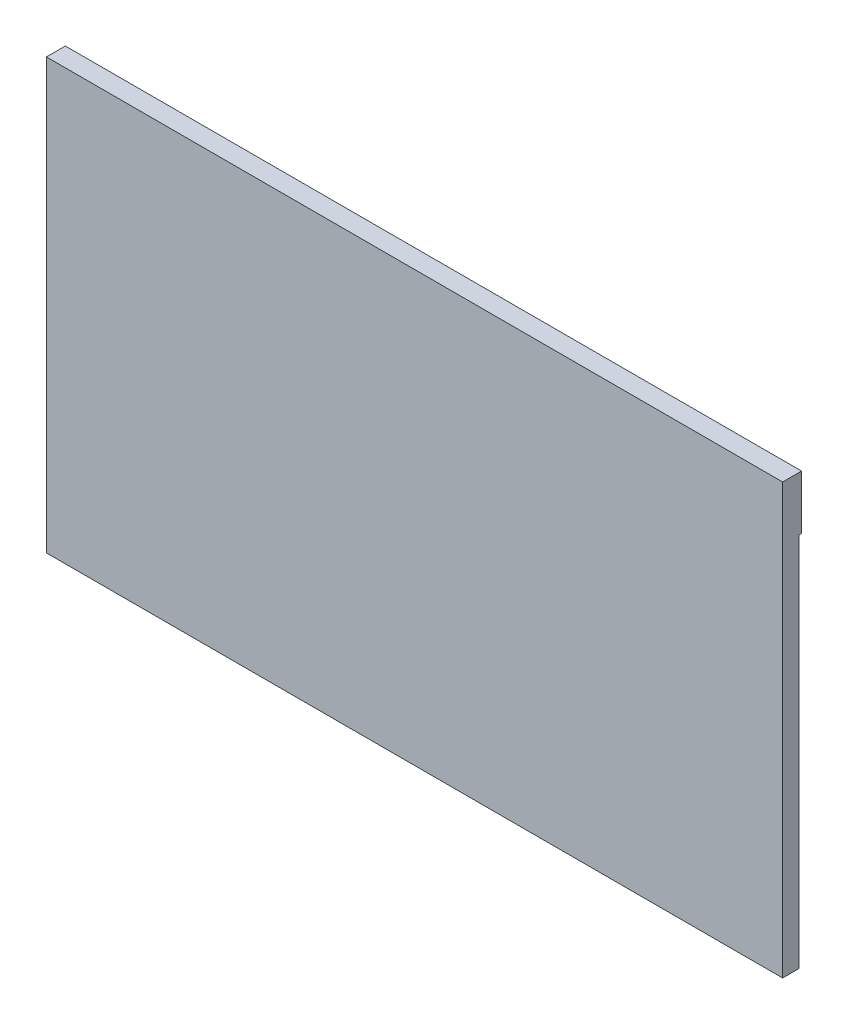
from build123d import *

# Parameters (mm, degrees)
ESQUISSE1_W        = 545
ESQUISSE1_H        = 318
BOSS_EXTRU_1_DEPTH = 12
ESQUISSE2_W        = 545
ESQUISSE2_H        = 40
BOSS_EXTRU_2_DEPTH = 2
ESQUISSE3_W        = 50
ESQUISSE3_H        = 30
BOSS_EXTRU_3_DEPTH = 4


with BuildPart() as part:
    # Esquisse1 → Boss.-Extru.1 (new body)
    with BuildSketch(Plane.XY):
        Rectangle(ESQUISSE1_W, ESQUISSE1_H)
    extrude(amount=BOSS_EXTRU_1_DEPTH)

    # Esquisse2 → Boss.-Extru.2 (add)
    with BuildSketch(Plane(origin=(0, 0, 0), x_dir=(-1, 0, 0), z_dir=(0, 0, -1))):
        with Locations((0, 139)):
            Rectangle(ESQUISSE2_W, ESQUISSE2_H)
    extrude(amount=BOSS_EXTRU_2_DEPTH)

    # Esquisse3 → Boss.-Extru.3 (add)
    with BuildSketch(Plane(origin=(0, 0, 0), x_dir=(-1, 0, 0), z_dir=(0, 0, -1))):
        with Locations((-172.5, 124)):
            Rectangle(ESQUISSE3_W, ESQUISSE3_H)
    extrude(amount=BOSS_EXTRU_3_DEPTH)


solid = part.part
